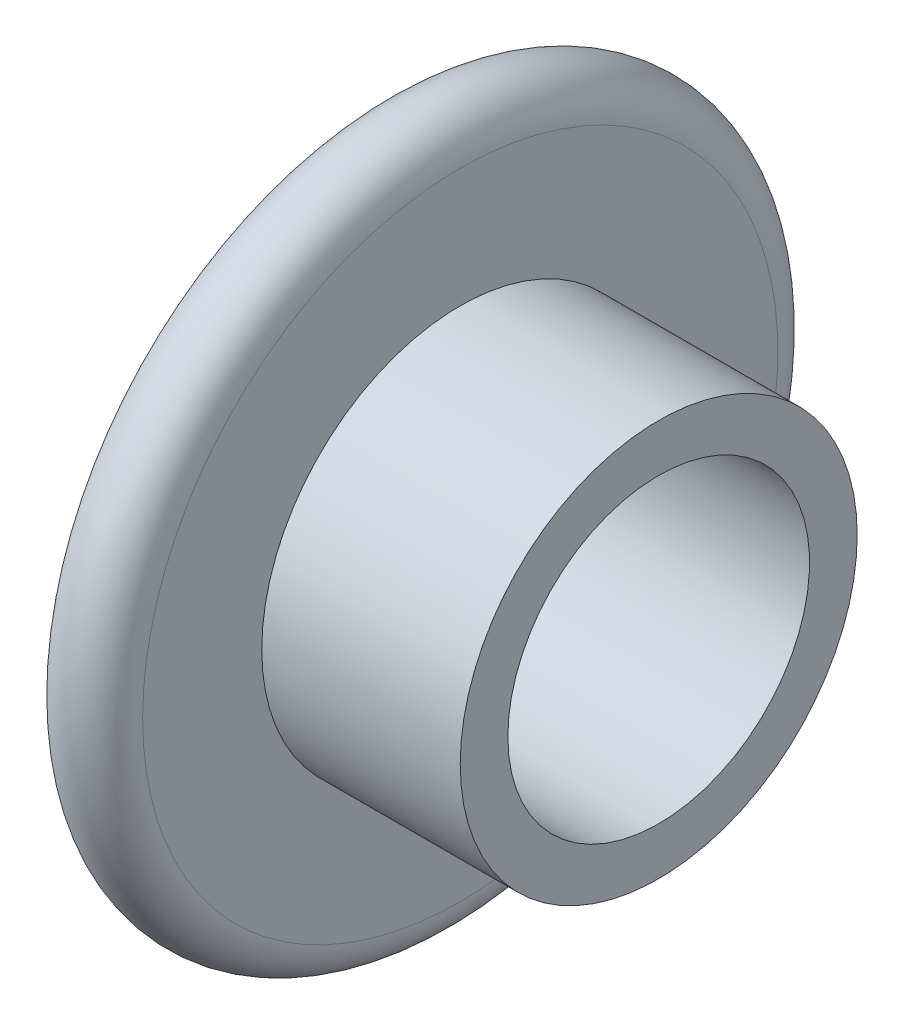
from build123d import *


with BuildPart() as part:
    # Sketch1 → Revolve1 (revolve)
    with BuildSketch(Plane.XY, mode=Mode.PRIVATE) as revolve1_sk:
        with BuildLine():
            Line((0, 19), (45, 19))
            Line((45, 19), (45, 25))
            Line((45, 25), (20, 25))
            Line((20, 25), (20, 40))
            ThreePointArc((20, 40), (15, 45), (10, 40))
            Line((10, 40), (10, 25))
            Line((10, 25), (0, 25))
            Line((0, 25), (0, 19))
        make_face()
    revolve(revolve1_sk.sketch.rotate(Axis((0, 0, 0), (1, 0, 0)), 90), axis=Axis((0, 0, 0), (1, 0, 0)))


solid = part.part
